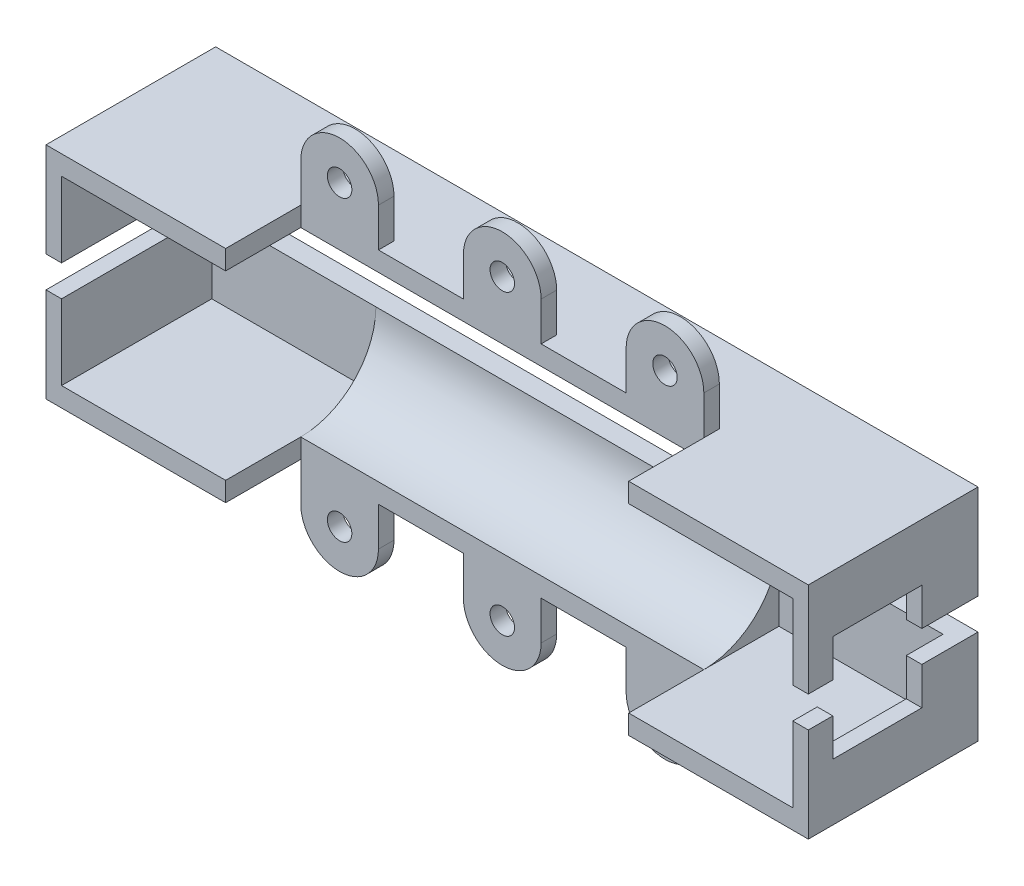
from build123d import *

# Parameters (mm, degrees)
BOSS_EXTRUDE1_DEPTH = 65.8876
BOSS_EXTRUDE2_DEPTH = 29.3624
BOSS_EXTRUDE3_DEPTH = 2.54
SKETCH4_R           = 2
BOSS_EXTRUDE4_DEPTH = 2.54
SKETCH6_W           = 24.561
SKETCH6_H           = 12.2809
BOSS_EXTRUDE5_DEPTH = 2.54


with BuildPart() as part:
    # Sketch1 → Boss-Extrude1 (new body)
    with BuildSketch(Plane(origin=(0, 0, 0), x_dir=(0, 0, -1), z_dir=(1, 0, 0))):
        with BuildLine():
            Line((34.207401555, 10.336569156), (37.382401555, 10.336569156))
            Line((37.382401555, 10.336569156), (37.382401555, -5.119330844))
            Line((37.382401555, -5.119330844), (21.926501555, -5.119330844))
            Line((21.926501555, -5.119330844), (21.926501555, -1.944330844))
            ThreePointArc((21.926501555, -1.944330844), (30.610409224, 1.652661487), (34.207401555, 10.336569156))
        make_face()
    extrude(amount=BOSS_EXTRUDE1_DEPTH)

    # Sketch2 → Boss-Extrude2 (add)
    with BuildSketch(Plane(origin=(65.8876, 0, 0), x_dir=(0, 0, -1), z_dir=(1, 0, 0))):
        Polygon((37.382401555, -1.944330844), (37.382401555, 10.336569156), (34.207401555, 10.336569156), (34.207401555, -1.944330844), (9.646401555, -1.944330844), (9.646401555, -5.119330844), (37.382401555, -5.119330844), align=None)
    boss_extrude2 = extrude(amount=BOSS_EXTRUDE2_DEPTH)

    # Sketch3 → Boss-Extrude3 (add)
    with BuildSketch(Plane(origin=(95.25, 0, 0), x_dir=(0, 0, -1), z_dir=(1, 0, 0))):
        Polygon((28.207401555, 4.196119156), (13.646401555, 4.196119156), (13.646401555, 10.336569156), (9.646401555, 10.336569156), (9.646401555, 4.196119156), (9.646401555, -1.944330844), (28.207401555, -1.944330844), (34.207401555, -1.944330844), (34.207401555, 10.336569156), (28.207401555, 10.336569156), align=None)
    extrude(amount=-BOSS_EXTRUDE3_DEPTH)

    # Sketch4 → Boss-Extrude4 (add)
    # profile 1 of 3: a face of its own
    with BuildSketch(Plane.XY.offset(-21.926501555)):
        with BuildLine():
            Line((0, -11.469330844), (0, -5.119330844))
            Line((0, -5.119330844), (12.7, -5.119330844))
            Line((12.7, -5.119330844), (12.7, -11.469330844))
            ThreePointArc((12.7, -11.469330844), (6.35, -17.819330844), (0, -11.469330844))
        make_face()
        with Locations((6.35, -11.469330844)):
            Circle(SKETCH4_R, mode=Mode.SUBTRACT)
    # profile 2 of 3: a face of its own
    with BuildSketch(Plane.XY.offset(-21.926501555)):
        with BuildLine():
            Line((26.5938, -11.469330844), (26.5938, -5.119330844))
            Line((26.5938, -5.119330844), (39.2938, -5.119330844))
            Line((39.2938, -5.119330844), (39.2938, -11.469330844))
            ThreePointArc((39.2938, -11.469330844), (32.9438, -17.819330844), (26.5938, -11.469330844))
        make_face()
        with Locations((32.9438, -11.469330844)):
            Circle(SKETCH4_R, mode=Mode.SUBTRACT)
    # profile 3 of 3: a face of its own
    with BuildSketch(Plane.XY.offset(-21.926501555)):
        with BuildLine():
            Line((53.1876, -5.119330844), (65.8876, -5.119330844))
            Line((65.8876, -5.119330844), (65.8876, -11.469330844))
            ThreePointArc((65.8876, -11.469330844), (59.5376, -17.819330844), (53.1876, -11.469330844))
            Line((53.1876, -11.469330844), (53.1876, -5.119330844))
        make_face()
        with Locations(Location((59.5376, -11.469330844, 0), (0, 0, 180))):
            Circle(SKETCH4_R, mode=Mode.SUBTRACT)
    extrude(amount=-BOSS_EXTRUDE4_DEPTH)

    # Mirror1: Boss-Extrude2 across plane
    add(boss_extrude2.mirror(Plane(origin=(32.9438, 0, 0), x_dir=(0, 0, 1), z_dir=(1, 0, 0))))

    # Sketch6 → Boss-Extrude5 (add)
    with BuildSketch(Plane.ZY.offset(29.3624)):
        with Locations((-21.926901555, 4.196119156)):
            Rectangle(SKETCH6_W, SKETCH6_H)
    extrude(amount=-BOSS_EXTRUDE5_DEPTH)


with BuildPart() as body_2:
    # Mirror3: mirrored copy
    add(part.part.mirror(Plane.ZX.offset(12.876569156)))


solid = Compound([part.part, body_2.part])
